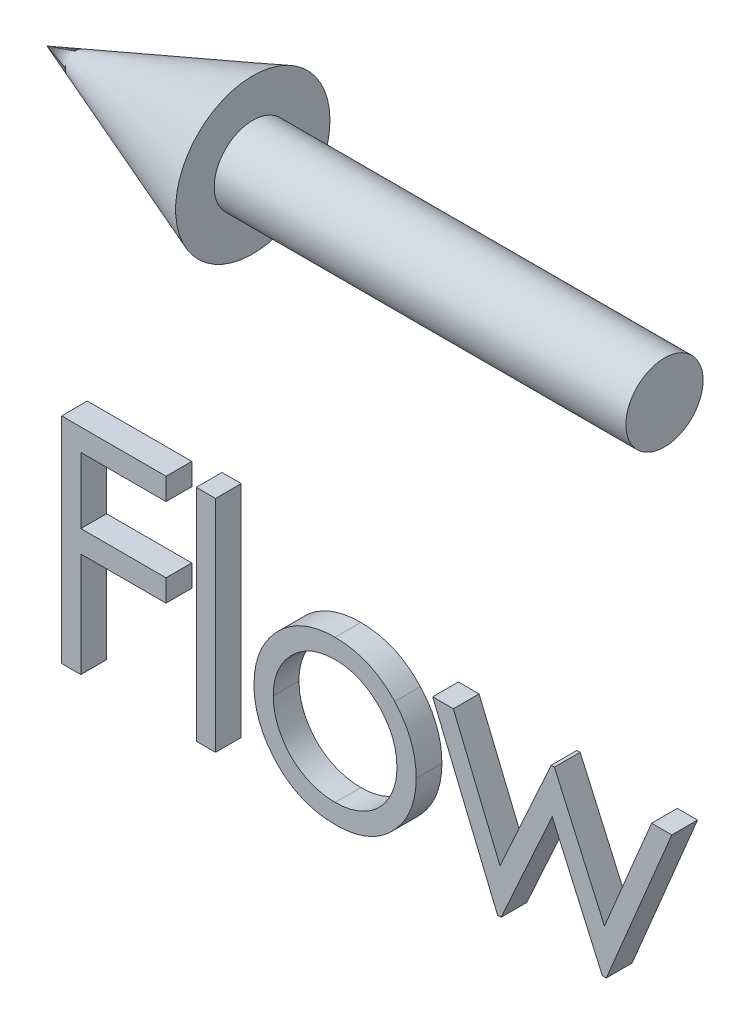
from build123d import *

# Parameters (mm, degrees)
BOSS_EXTRUDE1_DEPTH   = 3.175
SKETCH2_W             = 4.748931624
SKETCH2_H             = 54.273504274
BOSS_EXTRUDE1_2_DEPTH = 3.175
BOSS_EXTRUDE1_3_DEPTH = 3.175
BOSS_EXTRUDE1_4_DEPTH = 3.175


with BuildPart() as part:
    # Sketch1 → Revolve1 (revolve)
    with BuildSketch(Plane(origin=(0, 0, 0), x_dir=(1, 0, 0), z_dir=(0, 1, 0))):
        Polygon((0, 0), (0, 9.525), (-101.6, 9.525), (-101.6, 19.05), (-152.4, 0), align=None)
    revolve(axis=Axis((0, 0, 0), (-1, 0, 0)))


with BuildPart() as body_2:
    # Sketch2 → Boss-Extrude1 (new, symmetric)
    with BuildSketch(Plane.XY):
        Polygon((-145.615811966, -74.083333333), (-119.835897436, -74.083333333), (-119.835897436, -79.510683761), (-140.866880342, -79.510683761), (-140.866880342, -95.792735043), (-119.835897436, -95.792735043), (-119.835897436, -101.22008547), (-140.866880342, -101.22008547), (-140.866880342, -127), (-145.615811966, -127), align=None)
    extrude(amount=BOSS_EXTRUDE1_DEPTH, both=True)


with BuildPart() as body_3:
    # Sketch2 → Boss-Extrude1 2 (new, symmetric)
    with BuildSketch(Plane.XY):
        with Locations((-109.998824786, -99.863247863)):
            Rectangle(SKETCH2_W, SKETCH2_H)
    extrude(amount=BOSS_EXTRUDE1_2_DEPTH, both=True)


with BuildPart() as body_4:
    # Sketch2 → Boss-Extrude1 3 (new, symmetric)
    with BuildSketch(Plane.XY):
        with BuildLine():
            add(Edge.make_bspline(
                [(-78.091940438, -87.651709402), (-77.366358099, -87.667159422), (-75.943668454, -87.697453137), (-73.860144466, -88.021227023), (-71.871307291, -88.516335984), (-69.969539862, -89.200798887), (-68.179198252, -90.118252187), (-66.474204443, -91.213011708), (-64.859232999, -92.509962825), (-63.891265771, -93.51323362), (-63.399933226, -94.022485978)],
                knots=[0, 0, 0, 0, 1.054011418, 2.066658804, 3.057071809, 4.030435133, 4.997543892, 5.974964718, 6.972108034, 8, 8, 8, 8], degree=3))
            add(Edge.make_bspline(
                [(-63.399933226, -94.022485978), (-62.976872731, -94.509530763), (-62.138939125, -95.474194675), (-61.064493138, -97.038345014), (-60.138881455, -98.658201296), (-59.397096211, -100.355273973), (-58.812215496, -102.114748168), (-58.396960326, -103.942671432), (-58.149961429, -105.835006919), (-58.116654667, -107.120183995), (-58.099786325, -107.771067041)],
                knots=[0, 0, 0, 0, 1.025258237, 2.030674902, 3.01204498, 3.988269485, 4.97094183, 5.956517959, 6.965070386, 8, 8, 8, 8], degree=3))
            add(Edge.make_bspline(
                [(-58.099786325, -107.771067041), (-58.11462321, -108.425722675), (-58.143941588, -109.719352738), (-58.421279598, -111.62464553), (-58.852642444, -113.472114873), (-59.46998095, -115.254026076), (-60.261585697, -116.975825967), (-61.227552044, -118.629994153), (-62.374658637, -120.219794263), (-63.674957159, -121.731726817), (-65.112051001, -123.125192208), (-66.671068958, -124.33967914), (-68.321373992, -125.380195044), (-70.084910405, -126.218340852), (-71.945573598, -126.879189892), (-73.90737689, -127.343344903), (-75.967272596, -127.623979883), (-77.373755586, -127.660017241), (-78.091940438, -127.678418803)],
                knots=[0, 0, 0, 0, 0.998656419, 1.973391657, 2.932242238, 3.890759089, 4.846373663, 5.82037756, 6.809684879, 7.83454468, 8.860553229, 9.859544525, 10.845671541, 11.83227036, 12.833544569, 13.85385346, 14.904124723, 16, 16, 16, 16], degree=3))
            add(Edge.make_bspline(
                [(-78.091940438, -127.678418803), (-78.813643935, -127.65995548), (-80.227136695, -127.623794127), (-82.294303327, -127.34443521), (-84.259622566, -126.879403807), (-86.122721615, -126.216169095), (-87.893840134, -125.380168255), (-89.553707409, -124.342824853), (-91.113991846, -123.12483203), (-92.551389706, -121.73182441), (-93.851606715, -120.219769118), (-94.998734341, -118.630000679), (-95.964695225, -116.975824266), (-96.756301403, -115.25402653), (-97.373639526, -113.472114752), (-97.805002475, -111.624645563), (-98.082340457, -109.719352729), (-98.111658839, -108.425722672), (-98.126495726, -107.771067041)],
                knots=[0, 0, 0, 0, 1.099876186, 2.154163076, 3.173186993, 4.173200201, 5.163417411, 6.152872554, 7.150605724, 8.17532212, 9.198891216, 10.186952605, 11.159729845, 12.11414092, 13.071450619, 14.029093627, 15.002601286, 16, 16, 16, 16], degree=3))
            add(Edge.make_bspline(
                [(-98.126495726, -107.771067041), (-98.109512344, -107.123721644), (-98.075888165, -105.842089013), (-97.829137611, -103.953310834), (-97.415502293, -102.128481261), (-96.829920465, -100.375798469), (-96.081297936, -98.68616271), (-95.16869275, -97.062303956), (-94.083286758, -95.505226496), (-93.248685824, -94.541809334), (-92.826348825, -94.054286859)],
                knots=[0, 0, 0, 0, 1.031353054, 2.041901799, 3.029428768, 4.008703097, 4.981709435, 5.96992636, 6.972712378, 8, 8, 8, 8], degree=3))
            add(Edge.make_bspline(
                [(-92.826348825, -94.054286859), (-92.335757032, -93.540618135), (-91.370921947, -92.530398204), (-89.747911421, -91.237227899), (-88.047111983, -90.119687259), (-86.236985123, -89.220463525), (-84.336780009, -88.512309745), (-82.337750985, -88.019950171), (-80.247156882, -87.698619685), (-78.817505468, -87.667501997), (-78.091940438, -87.651709402)],
                knots=[0, 0, 0, 0, 1.027980169, 2.021703884, 2.998553061, 3.971491411, 4.943284454, 5.930300938, 6.949603206, 8, 8, 8, 8], degree=3))
        make_face()
        with BuildLine():
            add(Edge.make_bspline(
                [(-78.113141026, -92.400641026), (-78.626245387, -92.415224733), (-79.639208404, -92.444015672), (-81.130242601, -92.662998517), (-82.56564731, -93.009942924), (-83.948145786, -93.502885203), (-85.273075893, -94.13938046), (-86.541706144, -94.92116162), (-87.757768033, -95.837874177), (-88.897473038, -96.888083617), (-89.94344371, -98.035301748), (-90.857813119, -99.257651936), (-91.635311751, -100.53530741), (-92.283014154, -101.869596792), (-92.76542045, -103.274041622), (-93.11577448, -104.732736879), (-93.334550735, -106.248654486), (-93.363070983, -107.279184167), (-93.377564103, -107.802867922)],
                knots=[0, 0, 0, 0, 1.021534396, 2.016698045, 2.994645724, 3.958388632, 4.93408049, 5.916473867, 6.921342795, 7.962252576, 8.998418191, 10.008913653, 10.997312074, 11.973003931, 12.956656626, 13.948281152, 14.957379055, 16, 16, 16, 16], degree=3))
            add(Edge.make_bspline(
                [(-93.377564103, -107.802867922), (-93.35327046, -108.479475952), (-93.305052121, -109.822416368), (-92.912936046, -111.800155961), (-92.256976815, -113.698833963), (-91.371192943, -115.5073198), (-90.261360827, -117.180579241), (-88.953758748, -118.672398112), (-87.462420421, -119.960326452), (-85.805123334, -121.028953521), (-84.015718766, -121.878035542), (-82.121962482, -122.479758151), (-80.146799608, -122.8709135), (-78.796959982, -122.909791744), (-78.113141026, -122.929487179)],
                knots=[0, 0, 0, 0, 1.016792936, 2.018143844, 3.017858371, 4.030088057, 5.03801393, 6.028138512, 7.003788237, 7.991172063, 8.984598303, 9.972568034, 10.972917682, 12, 12, 12, 12], degree=3))
            add(Edge.make_bspline(
                [(-78.113141026, -122.929487179), (-77.4293614, -122.90967699), (-76.079599413, -122.870572225), (-74.107180906, -122.481728165), (-72.218600617, -121.875399009), (-70.43105464, -121.029908455), (-68.774511945, -119.956268375), (-67.272447849, -118.679670769), (-65.976010514, -117.176628017), (-64.867276249, -115.505103474), (-63.96698621, -113.701637674), (-63.314097326, -111.799805533), (-62.921038587, -109.822505614), (-62.872947486, -108.479505852), (-62.848717949, -107.802867922)],
                knots=[0, 0, 0, 0, 1.02726834, 2.027799167, 3.010890988, 4.004497153, 4.992059811, 5.971914811, 6.958719428, 7.966827853, 8.981595046, 9.981490638, 10.983022906, 12, 12, 12, 12], degree=3))
            add(Edge.make_bspline(
                [(-62.848717949, -107.802867922), (-62.863206079, -107.279181038), (-62.891716507, -106.248645197), (-63.110564183, -104.732772387), (-63.46065389, -103.273911343), (-63.944034293, -101.870077484), (-64.58892236, -100.531852716), (-65.381414351, -99.261403271), (-66.292050092, -98.031067396), (-67.350642277, -96.891792113), (-68.489157633, -95.837464774), (-69.705712377, -94.920806149), (-70.972461458, -94.142816312), (-72.29354241, -93.497441008), (-73.676218135, -93.014427648), (-75.109611636, -92.660995244), (-76.594284119, -92.44494108), (-77.603617272, -92.415502156), (-78.113141026, -92.400641026)],
                knots=[0, 0, 0, 0, 1.042956736, 2.052379634, 3.044323526, 4.02829302, 5.004299113, 5.996692471, 7.007513377, 8.048758398, 9.090003419, 10.095195979, 11.07790575, 12.047570684, 13.018257071, 13.989683339, 14.985167495, 16, 16, 16, 16], degree=3))
        make_face(mode=Mode.SUBTRACT)
    extrude(amount=BOSS_EXTRUDE1_3_DEPTH, both=True)


with BuildPart() as body_5:
    # Sketch2 → Boss-Extrude1 4 (new, symmetric)
    with BuildSketch(Plane.XY):
        Polygon((-54.029273504, -88.330128205), (-48.930532185, -88.330128205), (-37.408012821, -116.145299145), (-24.783062901, -88.330128205), (-23.977440572, -88.330128205), (-11.628098291, -116.145299145), (0.000424012, -88.330128205), (4.993162393, -88.330128205), (-11.172285657, -127), (-12.158112981, -127), (-24.518055556, -99.18482906), (-37.132405182, -127), (-38.012229567, -127), align=None)
    extrude(amount=BOSS_EXTRUDE1_4_DEPTH, both=True)


solid = Compound([part.part, body_2.part, body_3.part, body_4.part, body_5.part])
